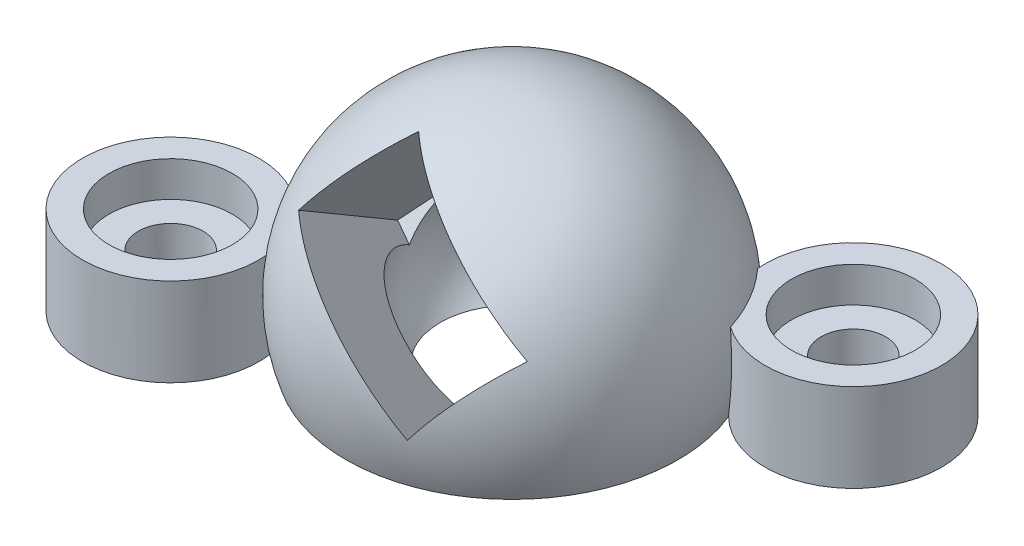
from build123d import *

# Parameters (mm, degrees)
RETAINER_FEATURE_3_PROFILE_R = 3
RETAINER_FEATURE_3_DEPTH     = 3
RETAINER_FEATURE_4_PROFILE_R = 3
RETAINER_FEATURE_4_DEPTH     = 3
RETAINER_FEATURE_6_PROFILE_R = 1.1
RETAINER_FEATURE_6_DEPTH     = 4.25
RETAINER_FEATURE_7_PROFILE_R = 2.1
RETAINER_FEATURE_7_DEPTH     = 1.45
RETAINER_FEATURE_8_PROFILE_R = 1.1
RETAINER_FEATURE_8_DEPTH     = 4.25
RETAINER_FEATURE_9_PROFILE_R = 2.1
RETAINER_FEATURE_9_DEPTH     = 1.45
RETAINER_FEATURE_12_DEPTH    = 10


with BuildPart() as part:
    # Retainer Dome Section Sketch → Retainer Dome (revolve)
    with BuildSketch(Plane(origin=(-42.218738434, 0, 24.375), x_dir=(-0.5000000000000002, 0, -0.8660254037844386), z_dir=(0.8660254037844386, 0, -0.5000000000000002)), mode=Mode.PRIVATE) as retainer_dome_sk:
        with BuildLine():
            Line((63.802679872, -71), (58.145825623, -71))
            Line((58.145825623, -71), (58.145825623, -79))
            ThreePointArc((58.145825623, -79), (63.044805109, -76.464101615), (63.802679872, -71))
        make_face()
    revolve(retainer_dome_sk.sketch.rotate(Axis((-71.291651246, -83, -25.980762114), (0, 1, 0)), 180), axis=Axis((-71.291651246, -83, -25.980762114), (0, 1, 0)))

    # Retainer Feature 3 profile → Retainer Feature 3 (add)
    with BuildSketch(Plane(origin=(0, -71, 0), x_dir=(-1, 0, 0), z_dir=(0, -1, 0))):
        with Locations((78.652867178, 21.730762114)):
            Circle(RETAINER_FEATURE_3_PROFILE_R)
    extrude(amount=RETAINER_FEATURE_3_DEPTH)

    # Retainer Feature 4 profile → Retainer Feature 4 (add)
    with BuildSketch(Plane(origin=(0, -71, 0), x_dir=(-1, 0, 0), z_dir=(0, -1, 0))):
        with Locations((63.930435314, 30.230762114)):
            Circle(RETAINER_FEATURE_4_PROFILE_R)
    extrude(amount=RETAINER_FEATURE_4_DEPTH)

    # Spherical Seat Sketch → Spherical Seat (revolve, cut)
    with BuildSketch(Plane(origin=(0, -73, 0), x_dir=(-1, 0, 0), z_dir=(0, -1, 0))):
        with BuildLine():
            Line((68.563671224, 27.555762114), (74.019631268, 24.405762114))
            ThreePointArc((74.019631268, 24.405762114), (72.866651246, 28.708742135), (68.563671224, 27.555762114))
        make_face()
    revolve(axis=Axis((-79.951905284, -73, -20.980762114), (0.8660254037844387, 0, -0.49999999999999994)), mode=Mode.SUBTRACT)

    # Retainer Feature 6 profile → Retainer Feature 6 (cut)
    with BuildSketch(Plane(origin=(0, -70, 0), x_dir=(-1, 0, 0), z_dir=(0, -1, 0))):
        with Locations(Location((78.652867178, 21.730762114, 0), (0, 0, 270))):
            Circle(RETAINER_FEATURE_6_PROFILE_R)
    extrude(amount=RETAINER_FEATURE_6_DEPTH, mode=Mode.SUBTRACT)

    # Retainer Feature 7 profile → Retainer Feature 7 (cut)
    with BuildSketch(Plane(origin=(0, -72.8, 0), x_dir=(-1, 0, 0), z_dir=(0, -1, 0))):
        with Locations(Location((78.652867178, 21.730762114, 0), (0, 0, 90))):
            Circle(RETAINER_FEATURE_7_PROFILE_R)
    extrude(amount=RETAINER_FEATURE_7_DEPTH, mode=Mode.SUBTRACT)

    # Retainer Feature 8 profile → Retainer Feature 8 (cut)
    with BuildSketch(Plane(origin=(0, -70, 0), x_dir=(-1, 0, 0), z_dir=(0, -1, 0))):
        with Locations(Location((63.930435314, 30.230762114, 0), (0, 0, 270))):
            Circle(RETAINER_FEATURE_8_PROFILE_R)
    extrude(amount=RETAINER_FEATURE_8_DEPTH, mode=Mode.SUBTRACT)

    # Retainer Feature 9 profile → Retainer Feature 9 (cut)
    with BuildSketch(Plane(origin=(0, -72.8, 0), x_dir=(-1, 0, 0), z_dir=(0, -1, 0))):
        with Locations(Location((63.930435314, 30.230762114, 0), (0, 0, 90))):
            Circle(RETAINER_FEATURE_9_PROFILE_R)
    extrude(amount=RETAINER_FEATURE_9_DEPTH, mode=Mode.SUBTRACT)

    # Middle Right Fixed Compression Ball Reta → Retainer Feature 12 (cut)
    with BuildSketch(Plane(origin=(1.086994367, -4.928521801, 7.638884182), x_dir=(0.9929271814083492, 0.06436591369238974, -0.09976292685669828), z_dir=(0.11872494439026324, -0.5383086561091619, 0.8343429620590547))):
        Polygon((-71.383097319, -72.025221064), (-76.603554069, -75.727494869), (-74.405328998, -78.827141064), (-69.184872248, -75.12486726), align=None)
    extrude(amount=RETAINER_FEATURE_12_DEPTH, mode=Mode.SUBTRACT)


with BuildPart() as body_2:
    # Mirror1: mirrored copy
    add(part.part.mirror(Plane(origin=(0, 0, 0), x_dir=(0, 0, 1), z_dir=(0, -1, 0))))


solid = body_2.part
